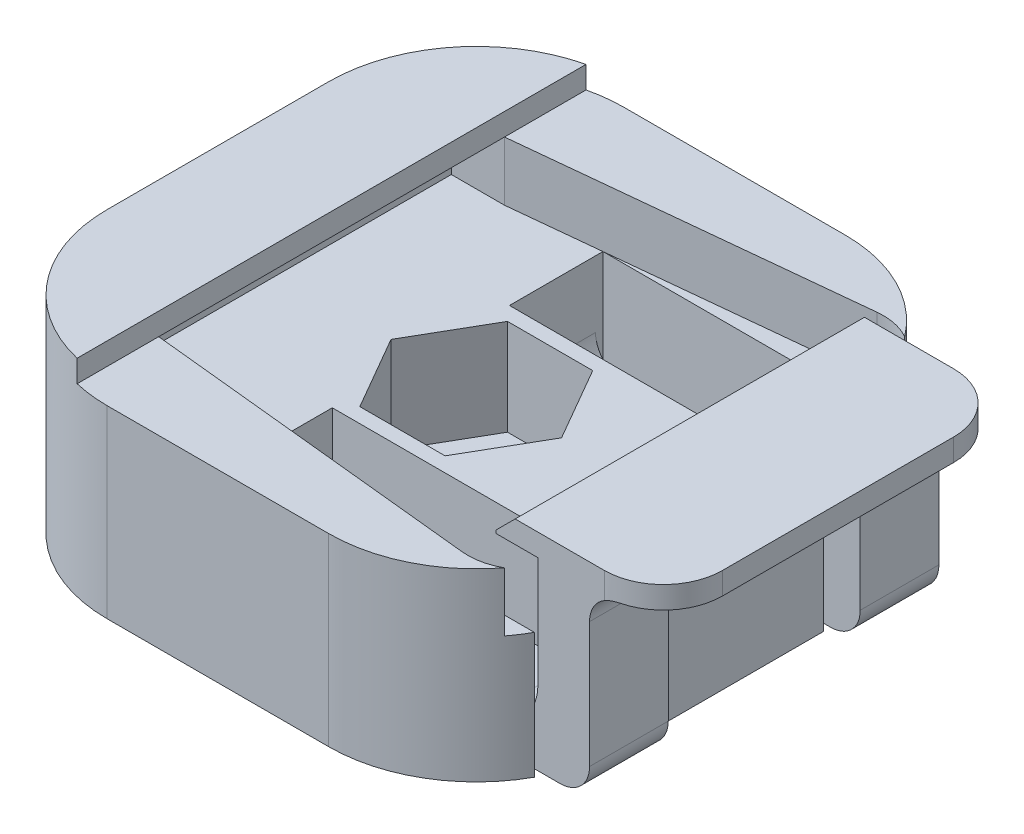
from build123d import *

# Parameters (mm, degrees)
ESQUISSE1_W                    = 35
ESQUISSE1_H                    = 35
BOSS_EXTRU_1_DEPTH             = 14
CONG_1_R                       = 10
ESQUISSE2_R                    = 3
ENL_V_MAT_EXTRU_1_DEPTH        = 29.434134416
ENL_V_MAT_EXTRU_2_DEPTH        = 12
ESQUISSE4_W                    = 31.334316994
ESQUISSE4_H                    = 39.173265385
ENL_V_MAT_EXTRU_3_DEPTH        = 1.5
ENL_V_MAT_EXTRU_4_DEPTH        = 4
ESQUISSE6_W                    = 23.42
ESQUISSE6_H                    = 4
ENL_V_MAT_EXTRU_5_DEPTH        = 3.6
CONG_2_R                       = 3
ESQUISSE7_W                    = 19.75277675
ESQUISSE7_H                    = 6.328012926
ENL_V_MAT_EXTRU_6_DEPTH        = 6.5
ENL_V_MAT_EXTRU_7_DEPTH        = 28.504545079
ENL_V_MAT_EXTRU_7_DEPTH_BACK   = 28.504545079
ESQUISSE8_W                    = 25.702062378
ESQUISSE8_H                    = 0.5
ESQUISSE8_W_2                  = 29.01148979
ESQUISSE8_W_3                  = 33.519235733
BOSS_EXTRU_2_START             = 4
BOSS_EXTRU_2_DEPTH             = 4
BOSS_EXTRU_3_DEPTH             = 1.5
CHANFREIN1_SIZE                = 1.3
CONG_3_R                       = 3
BOSS_EXTRU_4_REACH             = 43.56
ESQUISSE11_W                   = 5.328012926
ESQUISSE11_H                   = 12.5
BOSS_EXTRU_4_DIRECTION_2_DEPTH = 2
CONG_4_R                       = 2
CONG_5_R                       = 2


with BuildPart() as part:
    # Esquisse1 → Boss.-Extru.1 (new body)
    with BuildSketch(Plane(origin=(0, 0, 0), x_dir=(1, 0, 0), z_dir=(0, 1, 0))):
        Rectangle(ESQUISSE1_W, ESQUISSE1_H)
    extrude(amount=BOSS_EXTRU_1_DEPTH)

    # Congé1
    cong_1_edges = [part.edges().sort_by_distance(p)[0] for p in [
        (17.5, 7, 17.5),
        (-17.5, 7, 17.5),
        (-17.5, 7, -17.5),
        (17.5, 7, -17.5),
    ]]
    fillet(cong_1_edges, radius=CONG_1_R)

    # Esquisse2 → Enlèv. mat.-Extru.1 (cut, through all)
    with BuildSketch(Plane(origin=(0, 14, 0), x_dir=(1, 0, 0), z_dir=(0, 1, 0))):
        with Locations(Location((0, 0, 0), (0, 0, 270))):
            Circle(ESQUISSE2_R)
    extrude(amount=-ENL_V_MAT_EXTRU_1_DEPTH, mode=Mode.SUBTRACT)

    # Esquisse3 → Enlèv. mat.-Extru.2 (cut)
    with BuildSketch(Plane(origin=(0, 14, 0), x_dir=(1, 0, 0), z_dir=(0, 1, 0))):
        Polygon((5.773502692, 0), (2.886751346, 5), (-2.886751346, 5), (-5.773502692, 0), (-2.886751346, -5), (2.886751346, -5), align=None)
    extrude(amount=-ENL_V_MAT_EXTRU_2_DEPTH, mode=Mode.SUBTRACT)

    # Esquisse4 → Enlèv. mat.-Extru.3 (cut)
    with BuildSketch(Plane(origin=(0, 14, 0), x_dir=(1, 0, 0), z_dir=(0, 1, 0))):
        with Locations((5.867158497, -0.053691428)):
            Rectangle(ESQUISSE4_W, ESQUISSE4_H)
    extrude(amount=-ENL_V_MAT_EXTRU_3_DEPTH, mode=Mode.SUBTRACT)

    # Esquisse5 → Enlèv. mat.-Extru.4 (cut)
    with BuildSketch(Plane(origin=(0, 12.5, 0), x_dir=(1, 0, 0), z_dir=(0, 1, 0))):
        with BuildLine():
            Line((-9.8, 11.71), (-9.8, -11.71))
            Line((-9.8, -11.71), (13.093327001, -14.049647704))
            ThreePointArc((13.093327001, -14.049647704), (16.180793539, -13.03910228), (17.5, -10.070374269))
            Line((17.5, -10.070374269), (17.5, 10.070374269))
            ThreePointArc((17.5, 10.070374269), (16.180793539, 13.03910228), (13.093327001, 14.049647704))
            Line((13.093327001, 14.049647704), (-9.8, 11.71))
        make_face()
    extrude(amount=-ENL_V_MAT_EXTRU_4_DEPTH, mode=Mode.SUBTRACT)

    # Esquisse6 → Enlèv. mat.-Extru.5 (cut)
    with BuildSketch(Plane(origin=(-9.8, 0, 0), x_dir=(0, 0, -1), z_dir=(1, 0, 0))):
        with Locations((0, 10.5)):
            Rectangle(ESQUISSE6_W, ESQUISSE6_H)
    extrude(amount=-ENL_V_MAT_EXTRU_5_DEPTH, mode=Mode.SUBTRACT)

    # Congé2
    cong_2_edges = [part.edges().sort_by_distance(p)[0] for p in [
        (-13.4, 12.5, 0),
    ]]
    fillet(cong_2_edges, radius=CONG_2_R)

    # Esquisse7 → Enlèv. mat.-Extru.6 (cut)
    with BuildSketch(Plane(origin=(0, 8.5, 0), x_dir=(1, 0, 0), z_dir=(0, 1, 0))):
        with Locations((6.123611625, -9.164006463)):
            Rectangle(ESQUISSE7_W, ESQUISSE7_H)
        with Locations((6.123611625, 9.164006463)):
            Rectangle(ESQUISSE7_W, ESQUISSE7_H)
    extrude(amount=-ENL_V_MAT_EXTRU_6_DEPTH, mode=Mode.SUBTRACT)

    # Esquisse8 → Enlèv. mat.-Extru.7 (cut, two sides: drawn at the far end of the back side and taken through both)
    with BuildSketch(Plane(origin=(0, 2, 0), x_dir=(1, 0, 0), z_dir=(0, 1, 0)).offset(-ENL_V_MAT_EXTRU_7_DEPTH_BACK)):
        with Locations((9.098254439, 6.25)):
            Rectangle(ESQUISSE8_W, ESQUISSE8_H)
        with Locations((9.098254439, 12.078012926)):
            Rectangle(ESQUISSE8_W, ESQUISSE8_H)
        with Locations((10.752968145, -6.25)):
            Rectangle(ESQUISSE8_W_2, ESQUISSE8_H)
        with Locations((13.006841117, -12.078012926)):
            Rectangle(ESQUISSE8_W_3, ESQUISSE8_H)
    extrude(amount=ENL_V_MAT_EXTRU_7_DEPTH + ENL_V_MAT_EXTRU_7_DEPTH_BACK, mode=Mode.SUBTRACT)

    # Esquisse9 → Boss.-Extru.2 (add)
    with BuildSketch(Plane(origin=(0, 8.5, 0), x_dir=(1, 0, 0), z_dir=(0, 1, 0)).offset(BOSS_EXTRU_2_START)):
        with BuildLine():
            Line((17.5, -7.5), (17.5, -6.5))
            Line((17.5, -6.5), (16, -6.5))
            Line((16, -6.5), (16, -11.828012926))
            Line((16, -11.828012926), (16.514893461, -11.828012926))
            ThreePointArc((16.514893461, -11.828012926), (17.250613689, -9.719354116), (17.5, -7.5))
        make_face()
        with BuildLine():
            Line((17.5, 6.5), (17.5, 7.5))
            ThreePointArc((17.5, 7.5), (17.250613689, 9.719354116), (16.514893461, 11.828012926))
            Line((16.514893461, 11.828012926), (16, 11.828012926))
            Line((16, 11.828012926), (16, 6.5))
            Line((16, 6.5), (17.5, 6.5))
        make_face()
    extrude(amount=-BOSS_EXTRU_2_DEPTH)

    # Esquisse10 → Boss.-Extru.3 (add)
    with BuildSketch(Plane(origin=(0, 12.5, 0), x_dir=(1, 0, 0), z_dir=(0, 1, 0))):
        with BuildLine():
            Line((13.16, 11.828012926), (20.5, 11.828012926))
            ThreePointArc((20.5, 11.828012926), (23.328427125, 10.65644005), (24.5, 7.828012926))
            Line((24.5, 7.828012926), (24.5, -7.828012926))
            ThreePointArc((24.5, -7.828012926), (23.328427125, -10.65644005), (20.5, -11.828012926))
            Line((20.5, -11.828012926), (13.16, -11.828012926))
            Line((13.16, -11.828012926), (13.16, 11.828012926))
        make_face()
    extrude(amount=BOSS_EXTRU_3_DEPTH)

    # Chanfrein1
    chanfrein1_edges = [part.edges().sort_by_distance(p)[0] for p in [
        (13.16, 14, 0),
    ]]
    chamfer(chanfrein1_edges, length=CHANFREIN1_SIZE)

    # Congé3
    cong_3_edges = [part.edges().sort_by_distance(p)[0] for p in [
        (16, 2, 9.164006463),
        (16, 2, -9.164006463),
    ]]
    fillet(cong_3_edges, radius=CONG_3_R)

    # Esquisse11 → Boss.-Extru.4 (add, up to next)
    with BuildSketch(Plane(origin=(17.5, 0, 0), x_dir=(0, 0, -1), z_dir=(1, 0, 0)), mode=Mode.PRIVATE) as boss_extru_4_sk1:
        with Locations((-9.164006463, 6.25)):
            Rectangle(ESQUISSE11_W, ESQUISSE11_H)
    boss_extru_4_tool1 = extrude(boss_extru_4_sk1.sketch, amount=-BOSS_EXTRU_4_REACH, mode=Mode.PRIVATE) - part.part
    # Esquisse11 → Boss.-Extru.4 (add, up to next)
    with BuildSketch(Plane(origin=(17.5, 0, 0), x_dir=(0, 0, -1), z_dir=(1, 0, 0)), mode=Mode.PRIVATE) as boss_extru_4_sk2:
        with Locations((9.164006463, 6.25)):
            Rectangle(ESQUISSE11_W, ESQUISSE11_H)
    boss_extru_4_tool2 = extrude(boss_extru_4_sk2.sketch, amount=-BOSS_EXTRU_4_REACH, mode=Mode.PRIVATE) - part.part
    add(boss_extru_4_tool1.solids().sort_by_distance((17.5, 6.25, 9.164006))[0])
    add(boss_extru_4_tool2.solids().sort_by_distance((17.5, 6.25, -9.164006))[0])

    # Esquisse11 → Boss.-Extru.4 direction 2 (add)
    with BuildSketch(Plane(origin=(17.5, 0, 0), x_dir=(0, 0, -1), z_dir=(1, 0, 0))):
        with Locations((-9.164006463, 6.25)):
            Rectangle(ESQUISSE11_W, ESQUISSE11_H)
        with Locations((9.164006463, 6.25)):
            Rectangle(ESQUISSE11_W, ESQUISSE11_H)
    extrude(amount=BOSS_EXTRU_4_DIRECTION_2_DEPTH)

    # Congé4
    cong_4_edges = [part.edges().sort_by_distance(p)[0] for p in [
        (19.5, 12.5, -9.164006463),
        (19.5, 12.5, 9.164006463),
        (19.5, 0, -9.164006463),
        (19.5, 0, 9.164006463),
    ]]
    fillet(cong_4_edges, radius=CONG_4_R)

    # Congé5
    cong_5_edges = [part.edges().sort_by_distance(p)[0] for p in [
        (-3.75277675, 2, 9.164006463),
        (-3.75277675, 2, -9.164006463),
    ]]
    fillet(cong_5_edges, radius=CONG_5_R)


solid = part.part
